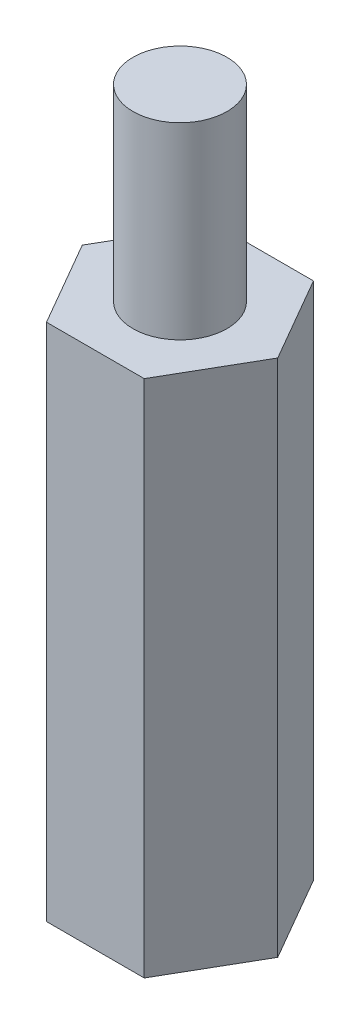
from build123d import *

# Parameters (mm, degrees)
SALIENTE_EXTRUIR1_DEPTH = 13.8
CROQUIS2_R              = 1.25
SALIENTE_EXTRUIR2_DEPTH = 5


with BuildPart() as part:
    # Croquis1 → Saliente-Extruir1 (new body)
    with BuildSketch(Plane(origin=(0, 0, 0), x_dir=(1, 0, 0), z_dir=(0, 1, 0))):
        Polygon((2.598076211, 0), (1.299038106, 2.25), (-1.299038106, 2.25), (-2.598076211, 0), (-1.299038106, -2.25), (1.299038106, -2.25), align=None)
    extrude(amount=SALIENTE_EXTRUIR1_DEPTH)

    # Croquis2 → Saliente-Extruir2 (add)
    with BuildSketch(Plane(origin=(0, 13.8, 0), x_dir=(1, 0, 0), z_dir=(0, 1, 0))):
        with Locations(Location((0, 0, 0), (0, 0, 270))):
            Circle(CROQUIS2_R)
    extrude(amount=SALIENTE_EXTRUIR2_DEPTH)


solid = part.part
